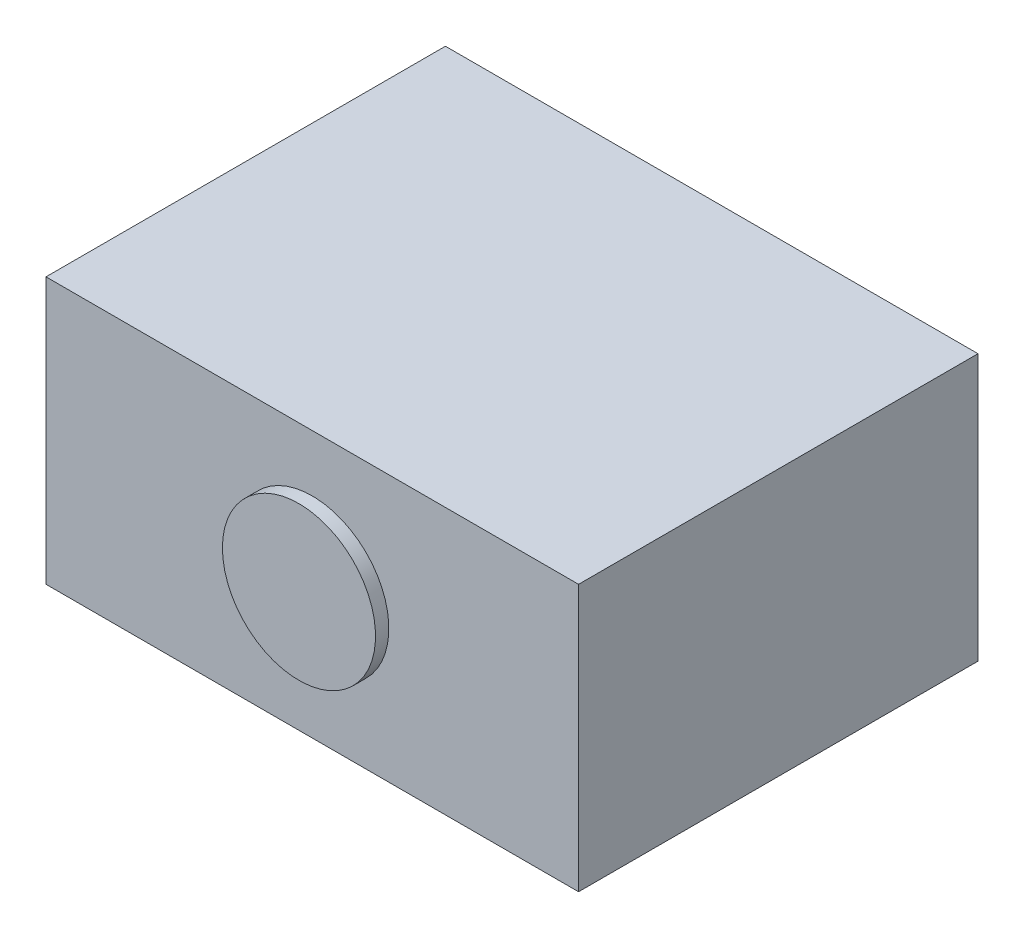
from build123d import *

# Parameters (mm, degrees)
BOSS_EXTRUDE1_DEPTH      = 150
BOSS_EXTRUDE1_DEPTH_BACK = 150
SKETCH1_W                = 400
SKETCH1_H                = 200
BOSS_EXTRUDE2_DEPTH      = 160
BOSS_EXTRUDE2_DEPTH_BACK = 160
SKETCH2_R                = 57.5


with BuildPart() as part:
    # Sketch1 → Boss-Extrude1 (new, two sides: drawn at the far end of the back side and taken through both)
    with BuildSketch(Plane.XY.offset(-BOSS_EXTRUDE1_DEPTH_BACK)):
        Rectangle(SKETCH1_W, SKETCH1_H)
    extrude(amount=BOSS_EXTRUDE1_DEPTH + BOSS_EXTRUDE1_DEPTH_BACK)

    # Sketch2 → Boss-Extrude2 (add, two sides: drawn at the far end of the back side and taken through both)
    with BuildSketch(Plane(origin=(0, 0, 0), x_dir=(-1, 0, 0), z_dir=(0, 0, -1)).offset(-BOSS_EXTRUDE2_DEPTH_BACK)):
        Circle(SKETCH2_R)
    extrude(amount=BOSS_EXTRUDE2_DEPTH + BOSS_EXTRUDE2_DEPTH_BACK)


solid = part.part
